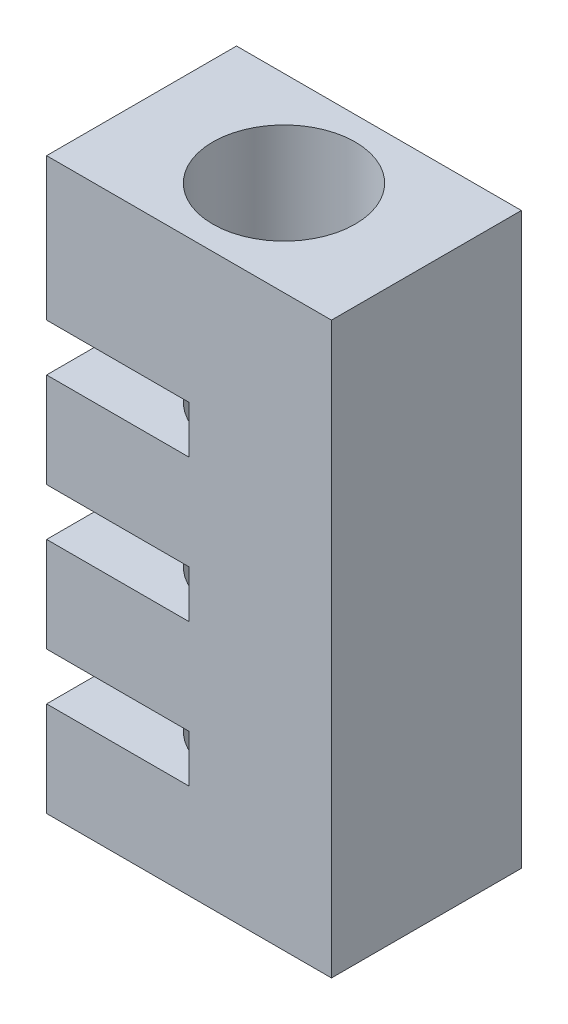
from build123d import *

# Parameters (mm, degrees)
BOSS_EXTRUDE1_DEPTH = 20
SKETCH4_R           = 7.5
CUT_EXTRUDE1_DEPTH  = 71


with BuildPart() as part:
    # Sketch1 → Boss-Extrude1 (new body)
    with BuildSketch(Plane.XY):
        Polygon((0, 0), (30, 0), (30, 60), (0, 60), (0, 45), (15, 45), (15, 40), (0, 40), (0, 30), (15, 30), (15, 25), (0, 25), (0, 15), (15, 15), (15, 10), (0, 10), align=None)
    extrude(amount=BOSS_EXTRUDE1_DEPTH)

    # Sketch4 → Cut-Extrude1 (cut, through all)
    with BuildSketch(Plane(origin=(0, 60, 0), x_dir=(1, 0, 0), z_dir=(0, 1, 0))):
        with Locations(Location((15, -10, 0), (0, 0, 270))):
            Circle(SKETCH4_R)
    extrude(amount=-CUT_EXTRUDE1_DEPTH, mode=Mode.SUBTRACT)


solid = part.part
